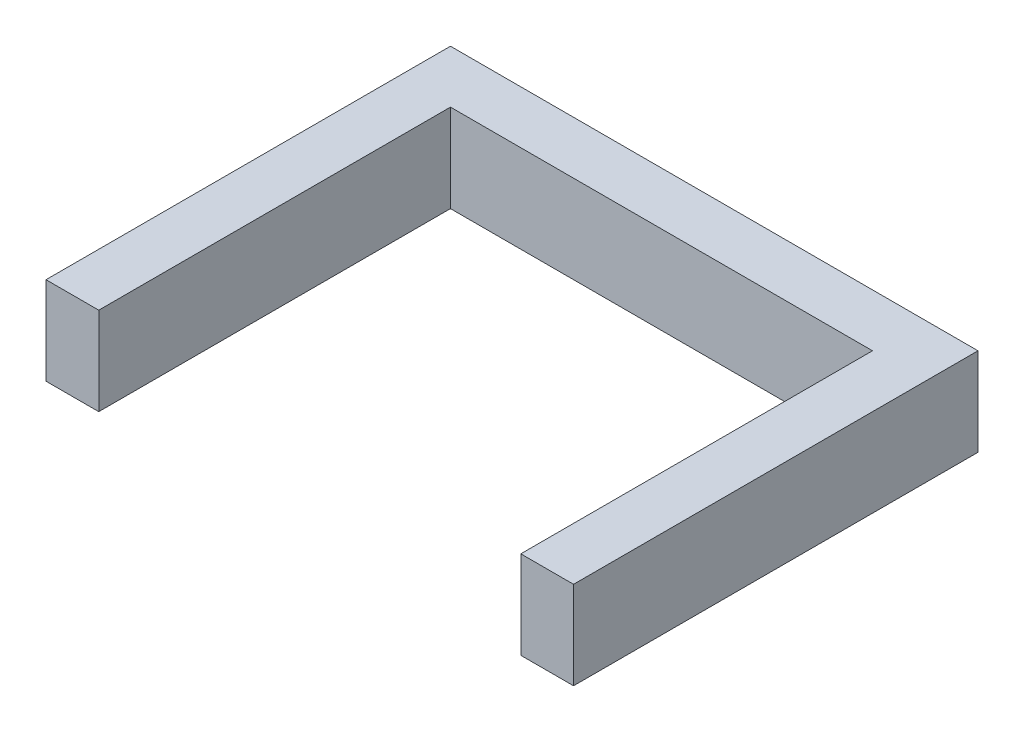
from build123d import *

# Parameters (mm, degrees)
EXTRUDE_2_DEPTH = 5


with BuildPart() as part:
    # 草图3 → 凸台-拉伸2 (new body)
    with BuildSketch(Plane(origin=(0, 0, 0), x_dir=(1, 0, 0), z_dir=(0, 1, 0))):
        Polygon((-15, 3), (15, 3), (15, -20), (12, -20), (12, 0), (-12, 0), (-12, -20), (-15, -20), align=None)
    extrude(amount=EXTRUDE_2_DEPTH)


solid = part.part
